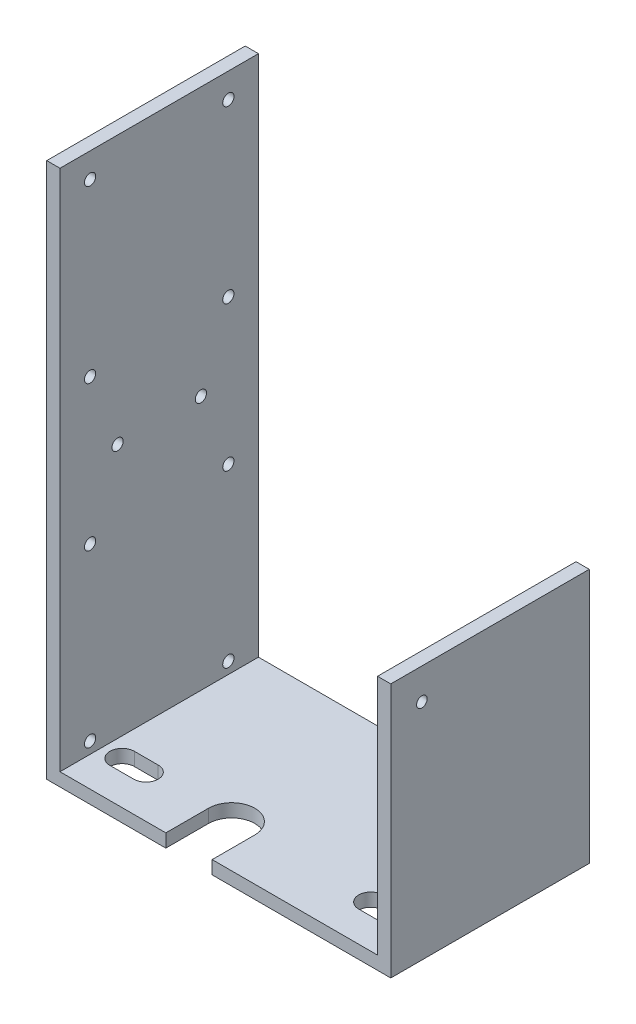
from build123d import *

# Parameters (mm, degrees)
SALIENTE_EXTRUIR1_DEPTH = 30
CROQUIS2_R              = 0.8
CORTAR_EXTRUIR1_DEPTH   = 2
CROQUIS3_R              = 0.85
CORTAR_EXTRUIR2_DEPTH   = 2
CORTAR_EXTRUIR3_DEPTH   = 2


with BuildPart() as part:
    # Croquis1 → Saliente-Extruir1 (new body)
    with BuildSketch(Plane.XY):
        Polygon((0, 0), (0, 81), (2, 81), (2, 2), (50, 2), (50, 38.5), (52, 38.5), (52, 0), align=None)
    extrude(amount=SALIENTE_EXTRUIR1_DEPTH)

    # Croquis2 → Cortar-Extruir1 (cut)
    with BuildSketch(Plane(origin=(52, 0, 0), x_dir=(0, 0, -1), z_dir=(1, 0, 0))):
        with Locations(Location((-25.3, 33.8, 0), (0, 0, 90))):
            Circle(CROQUIS2_R)
    extrude(amount=-CORTAR_EXTRUIR1_DEPTH, mode=Mode.SUBTRACT)

    # Croquis3 → Cortar-Extruir2 (cut)
    with BuildSketch(Plane.ZY):
        with Locations((4.55, 77.25)):
            Circle(CROQUIS3_R)
        with Locations((25.45, 77.25)):
            Circle(CROQUIS3_R)
        with Locations((25.45, 51.45)):
            Circle(CROQUIS3_R)
        with Locations((4.55, 51.45)):
            Circle(CROQUIS3_R)
        with Locations(Location((25.45, 29.55, 0), (0, 0, 270))):
            Circle(CROQUIS3_R)
        with Locations(Location((4.55, 29.55, 0), (0, 0, 270))):
            Circle(CROQUIS3_R)
        with Locations(Location((25.45, 3.75, 0), (0, 0, 270))):
            Circle(CROQUIS3_R)
        with Locations(Location((4.55, 3.75, 0), (0, 0, 270))):
            Circle(CROQUIS3_R)
        with Locations((8.7, 40.5)):
            Circle(CROQUIS3_R)
        with Locations((21.3, 40.5)):
            Circle(CROQUIS3_R)
    extrude(amount=-CORTAR_EXTRUIR2_DEPTH, mode=Mode.SUBTRACT)

    # Croquis4 → Cortar-Extruir3 (cut)
    with BuildSketch(Plane.XZ):
        with BuildLine():
            Line((4.95, 25.4), (8.55, 25.4))
            ThreePointArc((8.55, 25.4), (10.4, 23.55), (8.55, 21.7))
            Line((8.55, 21.7), (4.95, 21.7))
            ThreePointArc((4.95, 21.7), (3.1, 23.55), (4.95, 25.4))
        make_face()
        with BuildLine():
            Line((42.55, 25.4), (46.15, 25.4))
            ThreePointArc((46.15, 25.4), (48, 23.55), (46.15, 21.7))
            Line((46.15, 21.7), (42.55, 21.7))
            ThreePointArc((42.55, 21.7), (40.7, 23.55), (42.55, 25.4))
        make_face()
        with BuildLine():
            Line((18, 23.55), (18, 30))
            ThreePointArc((18, 30), (21.5, 33.5), (25, 30))
            Line((25, 30), (25, 23.55))
            ThreePointArc((25, 23.55), (21.5, 20.05), (18, 23.55))
        make_face()
    extrude(amount=-CORTAR_EXTRUIR3_DEPTH, mode=Mode.SUBTRACT)


solid = part.part
